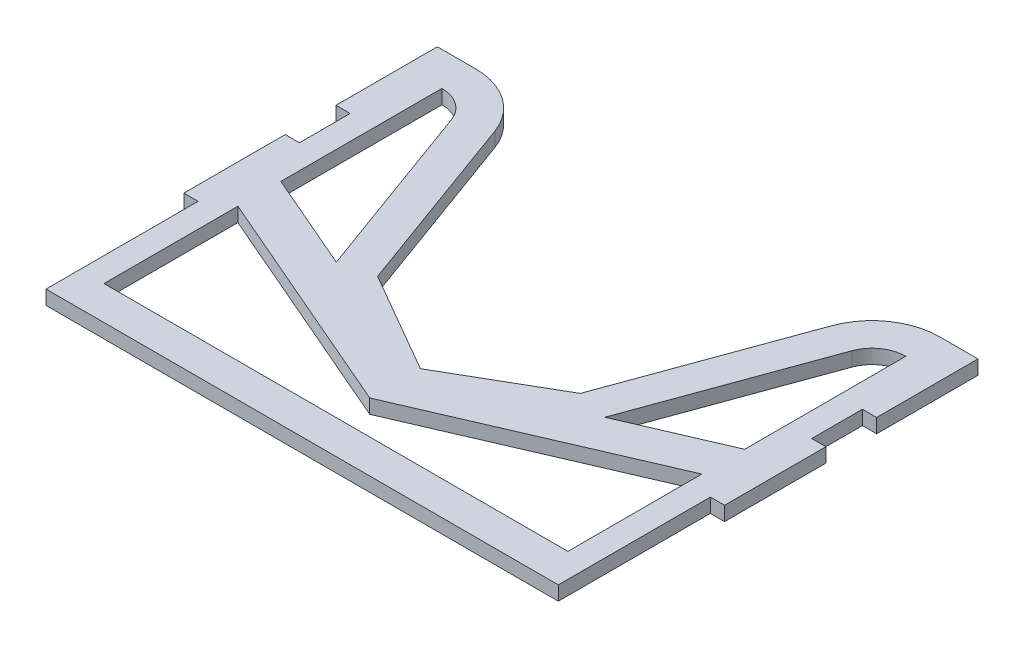
from build123d import *

# Parameters (mm, degrees)
SKETCH1_W              = 203.2
SKETCH1_H              = 152.4
BASE_DEPTH             = 5.334
CENTER_CUT_DEPTH       = 255.056000827
CENTER_CUT_DEPTH_BACK  = 255.056000827
SKETCH4_W              = 5.334
SKETCH4_H              = 19.05
SKETCH4_H_2            = 57.15
SLOTS_DEPTH            = 255.056000827
LEADING_EDGE_FILLET_R  = 25.4
WEIGHT_REDUCTION_DEPTH = 255.056000827


with BuildPart() as part:
    # Sketch1 → Base (new body)
    with BuildSketch(Plane(origin=(0, 0, 0), x_dir=(1, 0, 0), z_dir=(0, 1, 0))):
        with Locations((101.6, 76.2)):
            Rectangle(SKETCH1_W, SKETCH1_H)
    extrude(amount=BASE_DEPTH)

    # Sketch2 → Center Cut (cut, two sides: drawn at the far end of the back side and taken through both)
    with BuildSketch(Plane(origin=(0, 5.334, 0), x_dir=(1, 0, 0), z_dir=(0, 1, 0)).offset(-CENTER_CUT_DEPTH_BACK)):
        Polygon((-127.880204408, 592.259835398), (32.215682926, 152.4), (63.5, 66.447045256), (101.6, 44.45), (139.7, 66.447045256), (170.984317074, 152.4), (331.080204408, 592.259835398), (331.080204408, 1528.437955069), (-127.880204408, 1528.437955069), align=None)
    extrude(amount=CENTER_CUT_DEPTH + CENTER_CUT_DEPTH_BACK, mode=Mode.SUBTRACT)

    # Sketch4 → Slots (cut, through all)
    with BuildSketch(Plane(origin=(0, 5.334, 0), x_dir=(1, 0, 0), z_dir=(0, 1, 0))):
        with Locations((2.667, 104.775)):
            Rectangle(SKETCH4_W, SKETCH4_H)
        with Locations((200.533, 28.575)):
            Rectangle(SKETCH4_W, SKETCH4_H_2)
        with Locations((2.667, 28.575)):
            Rectangle(SKETCH4_W, SKETCH4_H_2)
        with Locations((200.533, 104.775)):
            Rectangle(SKETCH4_W, SKETCH4_H)
    extrude(amount=-SLOTS_DEPTH, mode=Mode.SUBTRACT)

    # Leading Edge Fillet
    leading_edge_fillet_edges = [part.edges().sort_by_distance(p)[0] for p in [
        (170.984317074, 2.667, -152.4),
        (32.215682926, 2.667, -152.4),
    ]]
    fillet(leading_edge_fillet_edges, radius=LEADING_EDGE_FILLET_R)

    # Sketch5 → Weight Reduction (cut, through all)
    with BuildSketch(Plane(origin=(0, 5.334, 0), x_dir=(1, 0, 0), z_dir=(0, 1, 0))):
        Polygon((14.430411455, 12.7), (188.769588545, 12.7), (188.769588545, 63.027385411), (101.6, 25.4), (14.430411455, 63.027385411), align=None)
        with BuildLine():
            Line((14.430411455, 139.7), (14.430411455, 79.156722924))
            Line((14.430411455, 79.156722924), (51.123931231, 63.31769886))
            Line((51.123931231, 63.31769886), (26.364507739, 131.34365582))
            ThreePointArc((26.364507739, 131.34365582), (21.714832197, 137.403230962), (14.430411455, 139.7))
        make_face()
        with BuildLine():
            Line((176.835492261, 131.34365582), (152.076068769, 63.31769886))
            Line((152.076068769, 63.31769886), (188.769588545, 79.156722924))
            Line((188.769588545, 79.156722924), (188.769588545, 139.7))
            ThreePointArc((188.769588545, 139.7), (181.485167803, 137.403230962), (176.835492261, 131.34365582))
        make_face()
    extrude(amount=-WEIGHT_REDUCTION_DEPTH, mode=Mode.SUBTRACT)


solid = part.part
